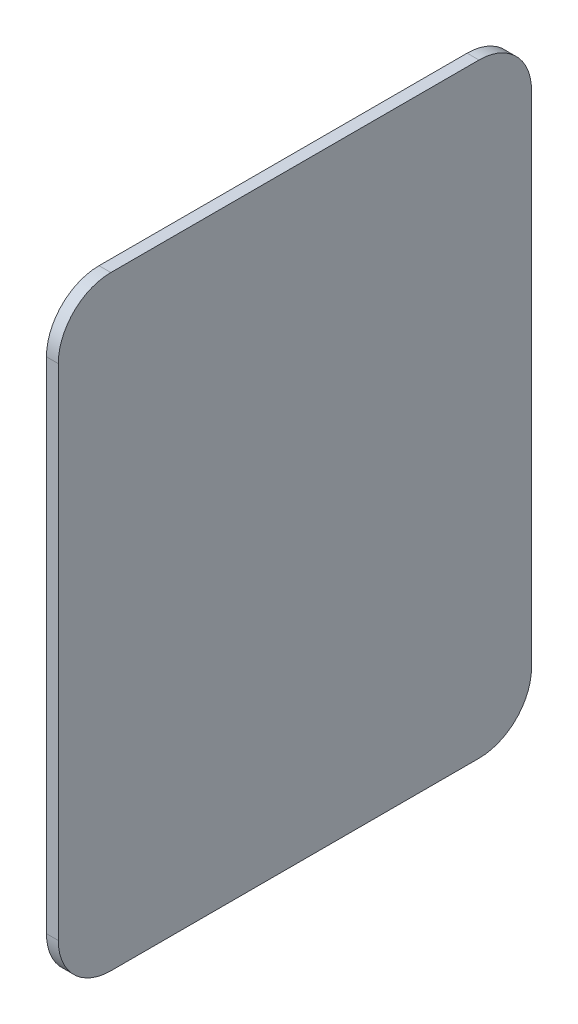
from build123d import *

# Parameters (mm, degrees)
EXTRUDE_1_DEPTH = 4.5


with BuildPart() as part:
    # 草图1 → 凸台-拉伸1 (new body)
    with BuildSketch(Plane(origin=(0, 0, 0), x_dir=(0, 0, -1), z_dir=(1, 0, 0))):
        with BuildLine():
            Line((70, -115), (-70, -115))
            ThreePointArc((-70, -115), (-84.142135624, -109.142135624), (-90, -95))
            Line((-90, -95), (-90, 95))
            ThreePointArc((-90, 95), (-84.142135624, 109.142135624), (-70, 115))
            Line((-70, 115), (70, 115))
            ThreePointArc((70, 115), (84.142135624, 109.142135624), (90, 95))
            Line((90, 95), (90, -95))
            ThreePointArc((90, -95), (84.142135624, -109.142135624), (70, -115))
        make_face()
    extrude(amount=EXTRUDE_1_DEPTH)


solid = part.part
